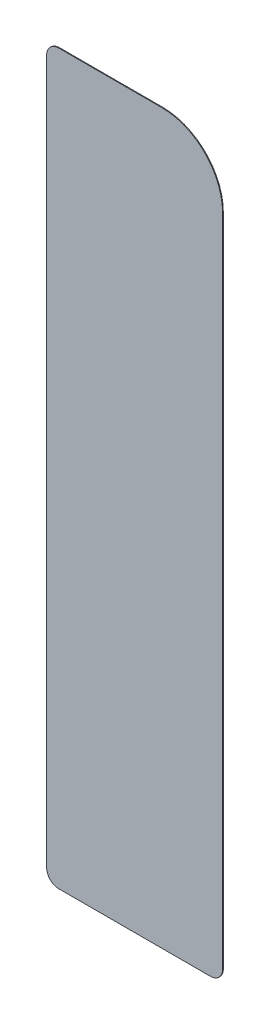
from build123d import *

# Parameters (mm, degrees)
BOSS_EXTRUDE6_DEPTH = 0.125


with BuildPart() as part:
    # Sketch17 → Boss-Extrude6 (new body)
    with BuildSketch(Plane.XY):
        with BuildLine():
            Line((-12.5, 60), (4.5, 60))
            ThreePointArc((4.5, 60), (11.571067812, 57.071067812), (14.5, 50))
            Line((14.5, 50), (14.5, -58))
            ThreePointArc((14.5, -58), (13.914213562, -59.414213562), (12.5, -60))
            Line((12.5, -60), (-12.5, -60))
            ThreePointArc((-12.5, -60), (-13.914213562, -59.414213562), (-14.5, -58))
            Line((-14.5, -58), (-14.5, 58))
            ThreePointArc((-14.5, 58), (-13.914213562, 59.414213562), (-12.5, 60))
        make_face()
    extrude(amount=BOSS_EXTRUDE6_DEPTH)


solid = part.part
